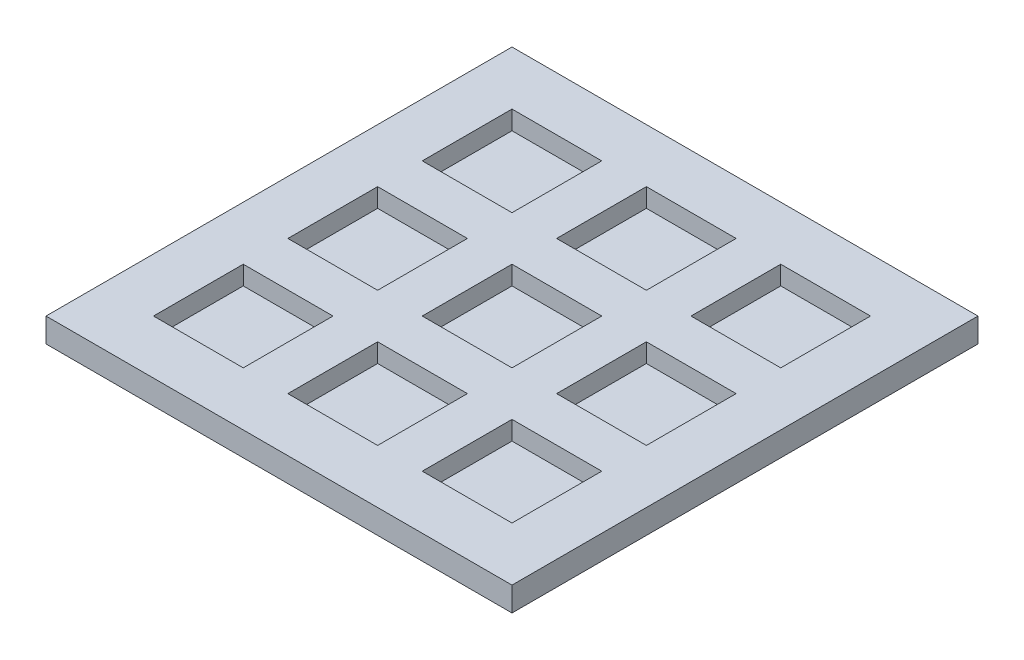
from build123d import *

# Parameters (mm, degrees)
ESQUISSE1_W        = 86.7
ESQUISSE1_H        = 86.7
ESQUISSE1_W_2      = 16.7
ESQUISSE1_H_2      = 16.7
BOSS_EXTRU_1_DEPTH = 3.5
ESQUISSE2_W        = 86.7
ESQUISSE2_H        = 86.7
BOSS_EXTRU_2_DEPTH = 1


with BuildPart() as part:
    # Esquisse1 → Boss.-Extru.1 (new body)
    with BuildSketch(Plane(origin=(0, 0, 0), x_dir=(1, 0, 0), z_dir=(0, 1, 0))):
        with Locations((43.35, 43.35)):
            Rectangle(ESQUISSE1_W, ESQUISSE1_H)
        with Locations((43.35, 18.35)):
            Rectangle(ESQUISSE1_W_2, ESQUISSE1_H_2, mode=Mode.SUBTRACT)
        with Locations((18.35, 18.35)):
            Rectangle(ESQUISSE1_W_2, ESQUISSE1_H_2, mode=Mode.SUBTRACT)
        with Locations((68.35, 18.35)):
            Rectangle(ESQUISSE1_W_2, ESQUISSE1_H_2, mode=Mode.SUBTRACT)
        with Locations((43.35, 43.35)):
            Rectangle(ESQUISSE1_W_2, ESQUISSE1_H_2, mode=Mode.SUBTRACT)
        with Locations((68.35, 43.35)):
            Rectangle(ESQUISSE1_W_2, ESQUISSE1_H_2, mode=Mode.SUBTRACT)
        with Locations((43.35, 68.35)):
            Rectangle(ESQUISSE1_W_2, ESQUISSE1_H_2, mode=Mode.SUBTRACT)
        with Locations((68.35, 68.35)):
            Rectangle(ESQUISSE1_W_2, ESQUISSE1_H_2, mode=Mode.SUBTRACT)
        with Locations((18.35, 43.35)):
            Rectangle(ESQUISSE1_W_2, ESQUISSE1_H_2, mode=Mode.SUBTRACT)
        with Locations((18.35, 68.35)):
            Rectangle(ESQUISSE1_W_2, ESQUISSE1_H_2, mode=Mode.SUBTRACT)
    extrude(amount=BOSS_EXTRU_1_DEPTH)

    # Esquisse2 → Boss.-Extru.2 (add)
    with BuildSketch(Plane.XZ):
        with Locations((43.35, -43.35)):
            Rectangle(ESQUISSE2_W, ESQUISSE2_H)
    extrude(amount=BOSS_EXTRU_2_DEPTH)


solid = part.part
